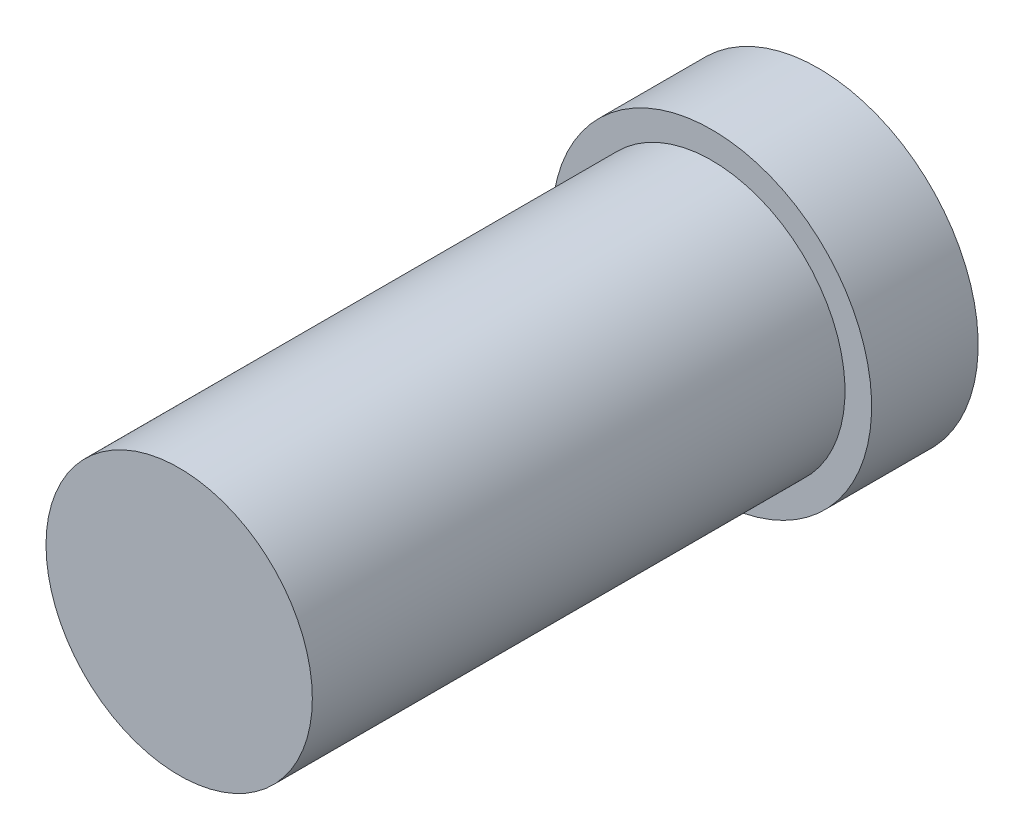
from build123d import *

# Parameters (mm, degrees)
IZIM1_R                     = 2.5
Y_KSEKLIK_EKSTR_ZYON1_DEPTH = 10
IZIM2_R                     = 3
Y_KSEKLIK_EKSTR_ZYON2_DEPTH = 2


with BuildPart() as part:
    # Çizim1 → Yükseklik-Ekstrüzyon1 (new body)
    with BuildSketch(Plane.XY):
        Circle(IZIM1_R)
    extrude(amount=Y_KSEKLIK_EKSTR_ZYON1_DEPTH)

    # Çizim2 → Yükseklik-Ekstrüzyon2 (add)
    with BuildSketch(Plane(origin=(0, 0, 0), x_dir=(-1, 0, 0), z_dir=(0, 0, -1))):
        Circle(IZIM2_R)
    extrude(amount=Y_KSEKLIK_EKSTR_ZYON2_DEPTH)


solid = part.part
